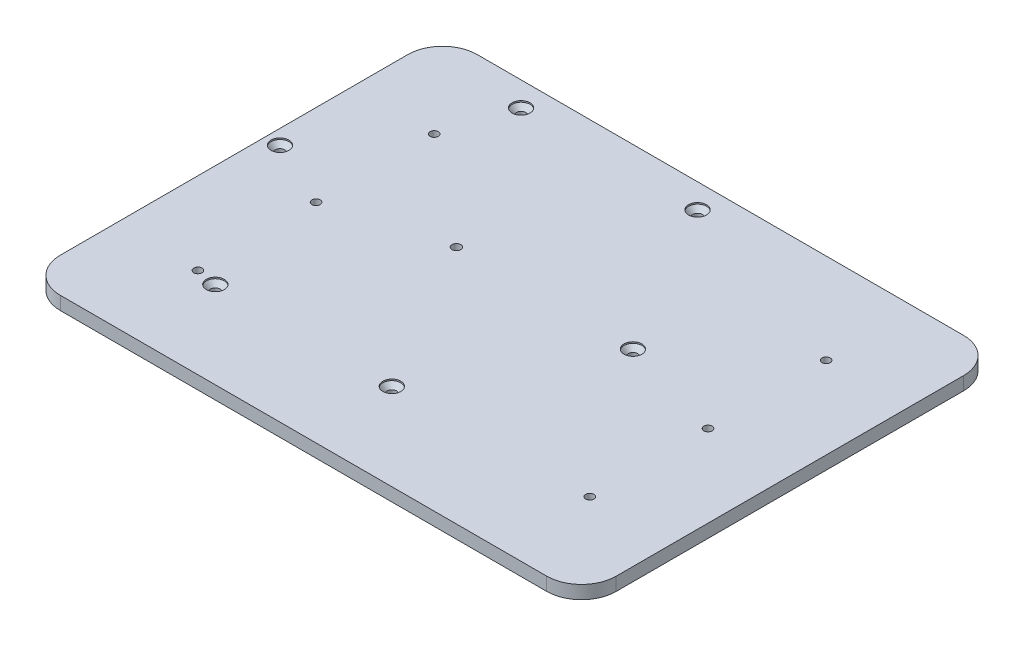
from build123d import *

# Parameters (mm, degrees)
EXTRUDE1_DEPTH                              = 9.525
SKETCH5_R                                   = 3.175
EXTRUDE2_DEPTH                              = 251.181385449
CIRPATTERN1_COUNT                           = 6
TAPPED_HOLE_FOR_10_32_HELICOIL1_D           = 5.1054
TAPPED_HOLE_FOR_10_32_HELICOIL1_CBORE_D     = 5.93598
TAPPED_HOLE_FOR_10_32_HELICOIL1_CBORE_DEPTH = 8.556


with BuildPart() as part:
    # Sketch1 → Extrude1 (new body)
    with BuildSketch(Plane(origin=(0, 0, 0), x_dir=(1, 0, 0), z_dir=(0, 1, 0))):
        with BuildLine():
            Line((-175, -150), (175, -150))
            ThreePointArc((175, -150), (192.67766953, -142.67766953), (200, -125))
            Line((200, -125), (200, 125))
            ThreePointArc((200, 125), (192.67766953, 142.67766953), (175, 150))
            Line((175, 150), (-175, 150))
            ThreePointArc((-175, 150), (-192.67766953, 142.67766953), (-200, 125))
            Line((-200, 125), (-200, -125))
            ThreePointArc((-200, -125), (-192.67766953, -142.67766953), (-175, -150))
        make_face()
    extrude(amount=EXTRUDE1_DEPTH)

    # Sketch5 → Extrude2 (cut, through all)
    with BuildSketch(Plane(origin=(0, 9.525, 0), x_dir=(1, 0, 0), z_dir=(0, 1, 0))):
        with Locations(Location((-62.5, 22.525, 0), (0, 0, 270))):
            Circle(SKETCH5_R)
    extrude(amount=-EXTRUDE2_DEPTH, mode=Mode.SUBTRACT)

    # Sketch3 → CSK for 1/4 Flat Head Machine Screw1 (revolve, cut)
    with BuildSketch(Plane(origin=(-189.5, 9.525, -22.525), x_dir=(0, 0, 1), z_dir=(1, 0, 0))):
        Polygon((0, 0), (0, 9.525), (3.3782, 9.525), (3.3782, 4.520932584), (6.4389, 1), (6.4389, 0), align=None)
    csk_for_1_4_flat_head_machine_screw1 = revolve(axis=Axis((-189.5, 15.875, -22.525), (0, -1, 0)), mode=Mode.SUBTRACT)

    # CirPattern1: CSK for 1/4 Flat Head Machine Screw1 ×6 about axis
    cirpattern1_axis = Axis((-62.5, 0, -22.525), (0, 1, 0))
    for i in range(1, CIRPATTERN1_COUNT):
        add(csk_for_1_4_flat_head_machine_screw1.rotate(cirpattern1_axis, i * 360 / CIRPATTERN1_COUNT), mode=Mode.SUBTRACT)

    # Tapped Hole for #10-32 Helicoil1 (through all)
    with Locations(Plane(origin=(0, 9.525, 0), x_dir=(-1, 0, 0), z_dir=(0, 1, 0))):
        with Locations((-141, 85), (141, -85), (141, 0), (141, 85), (-141, -85), (-141, 0)):
            CounterBoreHole(TAPPED_HOLE_FOR_10_32_HELICOIL1_D / 2, TAPPED_HOLE_FOR_10_32_HELICOIL1_CBORE_D / 2, TAPPED_HOLE_FOR_10_32_HELICOIL1_CBORE_DEPTH)


solid = part.part
